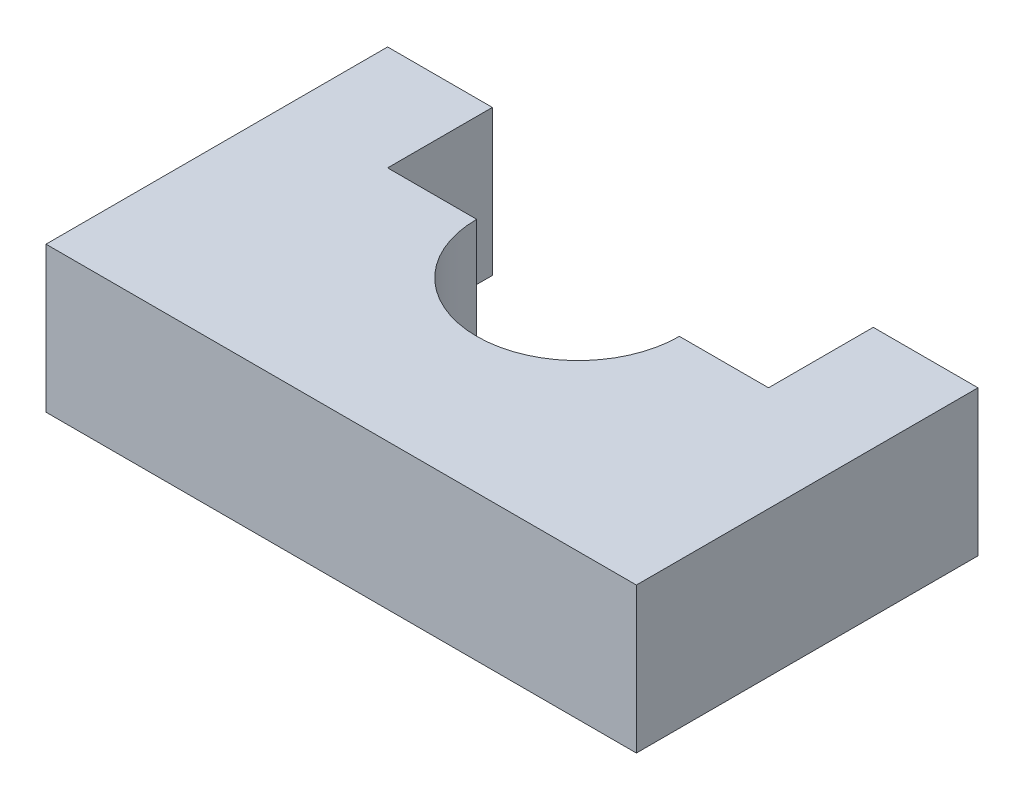
from build123d import *

# Parameters (mm, degrees)
BOSS_EXTRUDE1_DEPTH = 15


with BuildPart() as part:
    # Sketch4 → Boss-Extrude1 (new body)
    with BuildSketch(Plane(origin=(0, 0, 0), x_dir=(1, 0, 0), z_dir=(0, 1, 0))):
        with BuildLine():
            Line((-30.42245721, 0), (30.42245721, 0))
            Line((30.42245721, 0), (30.42245721, 35.206633949))
            Line((30.42245721, 35.206633949), (19.627391749, 35.206633949))
            Line((19.627391749, 35.206633949), (19.627391749, 24.411568487))
            Line((19.627391749, 24.411568487), (10.446516771, 24.411568487))
            ThreePointArc((10.446516771, 24.411568487), (0, 13.965051717), (-10.446516771, 24.411568487))
            Line((-10.446516771, 24.411568487), (-19.627391749, 24.411568487))
            Line((-19.627391749, 24.411568487), (-19.627391749, 35.206633949))
            Line((-19.627391749, 35.206633949), (-30.42245721, 35.206633949))
            Line((-30.42245721, 35.206633949), (-30.42245721, 0))
        make_face()
    extrude(amount=BOSS_EXTRUDE1_DEPTH)


solid = part.part
